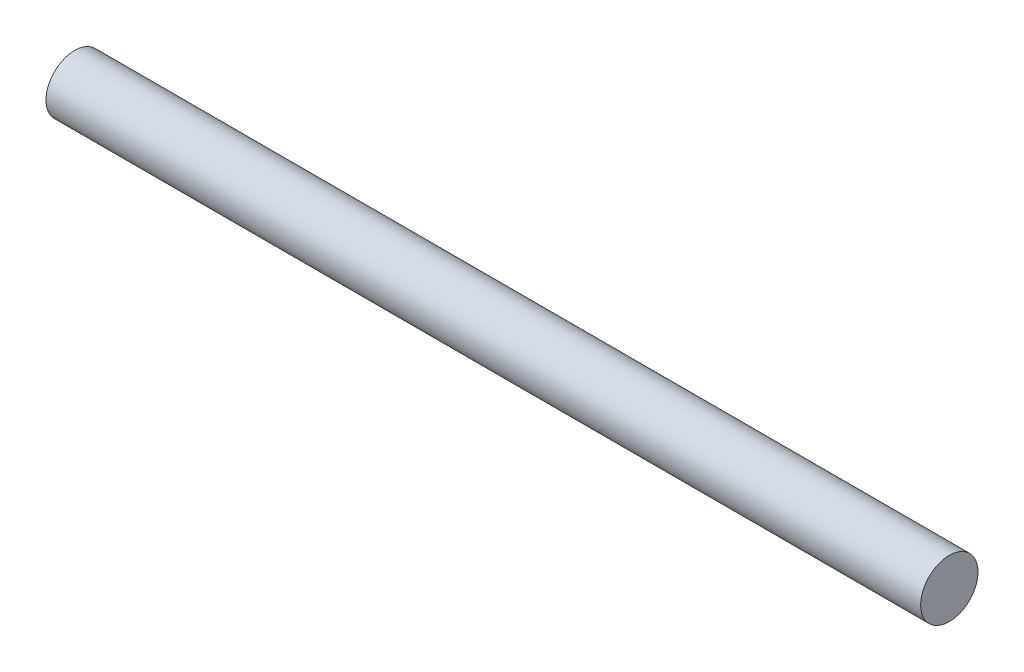
from build123d import *

# Parameters (mm, degrees)
SKETCH1_R           = 2.5
BOSS_EXTRUDE1_DEPTH = 38.1


with BuildPart() as part:
    # Sketch1 → Boss-Extrude1 (new, symmetric)
    with BuildSketch(Plane(origin=(0, 0, 0), x_dir=(0, 0, -1), z_dir=(1, 0, 0))):
        with Locations(Location((0, 0, 0), (0, 0, 180))):
            Circle(SKETCH1_R)
    extrude(amount=BOSS_EXTRUDE1_DEPTH, both=True)


solid = part.part
